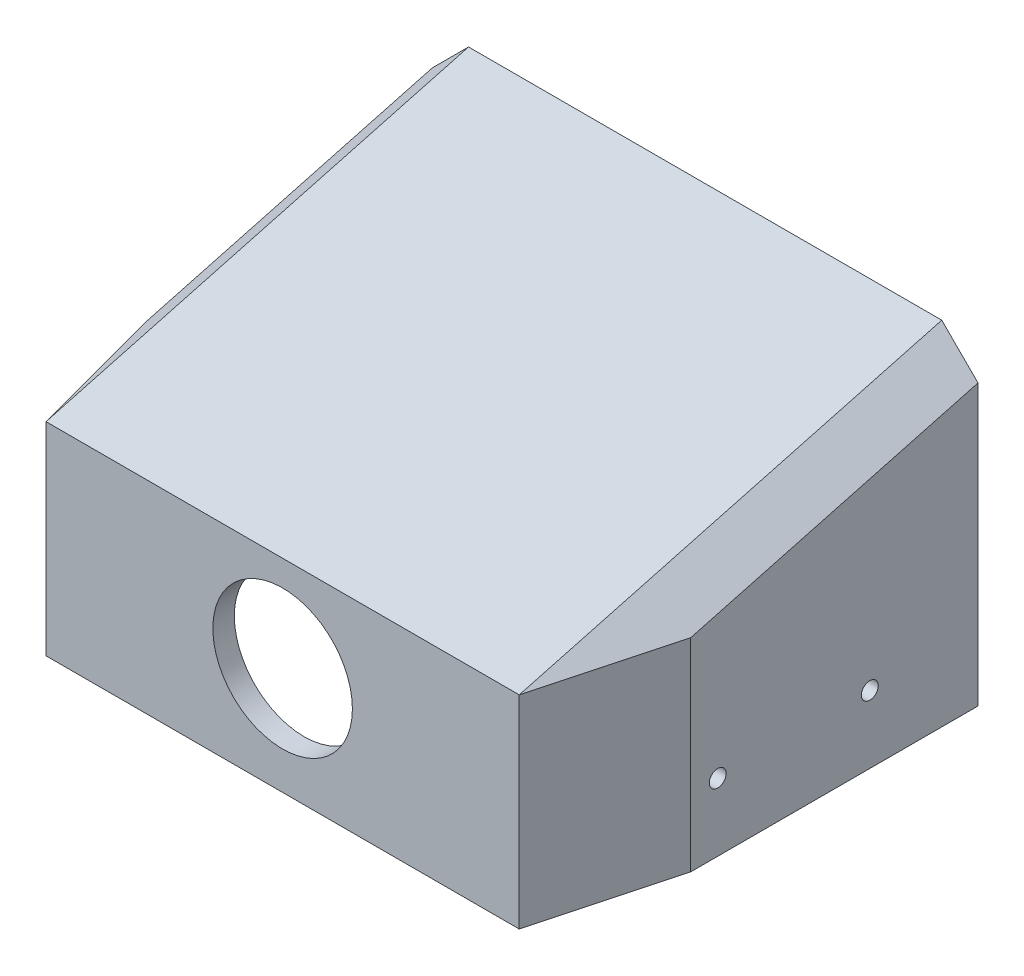
from build123d import *

# Parameters (mm, degrees)
BOSS_EXTRUDE1_DEPTH      = 60
BOSS_EXTRUDE2_DEPTH      = 70
BOSS_EXTRUDE2_DEPTH_BACK = 70
BOSS_EXTRUDE3_DEPTH      = 125
SKETCH5_W                = 177.8
SKETCH5_H                = 177.8
CUT_EXTRUDE1_DEPTH       = 206.048289966
SKETCH6_W                = 177.8
SKETCH6_H                = 177.8
CUT_EXTRUDE2_DEPTH       = 206.048289966
CUT_EXTRUDE5_START       = 93.49365
SKETCH10_W               = 39.282032303
SKETCH10_H               = 90
CUT_EXTRUDE5_DEPTH       = 247.327703168
SHELL1_T                 = -6.35
SKETCH7_R                = 20.64
CUT_EXTRUDE3_DEPTH       = 25.4
CUT_EXTRUDE4_START       = -25.4
SKETCH8_R                = 20.64
CUT_EXTRUDE4_DEPTH       = 25.4
CUT_EXTRUDE6_DEPTH       = 139.429414225
CUT_EXTRUDE6_DEPTH_BACK  = 139.429414225
SKETCH11_R               = 2.5


with BuildPart() as part:
    # Sketch1 → Boss-Extrude1 (new body)
    with BuildSketch(Plane(origin=(0, 0, 0), x_dir=(1, 0, 0), z_dir=(0, 1, 0))):
        Polygon((-103.493649054, 62.5), (103.493649054, 62.5), (70, -62.5), (-70, -62.5), align=None)
    extrude(amount=BOSS_EXTRUDE1_DEPTH)

    # Sketch2 → Boss-Extrude2 (add, two sides: drawn at the far end of the back side and taken through both)
    with BuildSketch(Plane(origin=(0, 0, 0), x_dir=(0, 0, -1), z_dir=(1, 0, 0)).offset(-BOSS_EXTRUDE2_DEPTH_BACK)):
        Polygon((-62.5, 60), (62.5, 93.493649054), (62.5, 60), align=None)
    extrude(amount=BOSS_EXTRUDE2_DEPTH + BOSS_EXTRUDE2_DEPTH_BACK)

    # Sketch4 → Boss-Extrude3 (add)
    with BuildSketch(Plane(origin=(0, 0, -62.5), x_dir=(-1, 0, 0), z_dir=(0, 0, -1))):
        Polygon((-70, 93.493649054), (-70, 60), (-103.493649054, 60), align=None)
        Polygon((70, 60), (103.493649054, 60), (70, 93.493649054), align=None)
    extrude(amount=-BOSS_EXTRUDE3_DEPTH)

    # Sketch5 → Cut-Extrude1 (cut, through all)
    with BuildSketch(Plane(origin=(70.830704378, 70.830704378, 18.979030037), x_dir=(0.7186724352001954, -0.6601192398037351, -0.21852350016499306), z_dir=(0.6947465906068516, 0.6947465906068802, 0.18615678789738468))):
        Rectangle(SKETCH5_W, SKETCH5_H)
    extrude(amount=CUT_EXTRUDE1_DEPTH, mode=Mode.SUBTRACT)

    # Sketch6 → Cut-Extrude2 (cut, through all)
    with BuildSketch(Plane(origin=(-70.830704378, 70.830704378, 18.979030037), x_dir=(0.7186724352001954, 0.6601192398037351, 0.21852350016499306), z_dir=(-0.6947465906068516, 0.6947465906068802, 0.18615678789738468))):
        Rectangle(SKETCH6_W, SKETCH6_H)
    extrude(amount=CUT_EXTRUDE2_DEPTH, mode=Mode.SUBTRACT)

    # Sketch10 → Cut-Extrude5 (cut, through all)
    with BuildSketch(Plane(origin=(0, 0, 0), x_dir=(1, 0, 0), z_dir=(0, 1, 0)).offset(CUT_EXTRUDE5_START)):
        with Locations((-100.358983849, 22.5)):
            Rectangle(SKETCH10_W, SKETCH10_H)
        with Locations((100.358983849, 22.5)):
            Rectangle(SKETCH10_W, SKETCH10_H)
    extrude(amount=-CUT_EXTRUDE5_DEPTH, mode=Mode.SUBTRACT)

    # Shell1
    shell1_openings = [part.faces().sort_by_distance(p)[0] for p in [
        (0, 0, -1.067232638),
    ]]
    offset(amount=SHELL1_T, openings=shell1_openings, kind=Kind.INTERSECTION)

    # Sketch7 → Cut-Extrude3 (cut)
    with BuildSketch(Plane(origin=(0, 0, -62.5), x_dir=(-1, 0, 0), z_dir=(0, 0, -1))):
        with Locations((0, 31.75)):
            Circle(SKETCH7_R)
    extrude(amount=-CUT_EXTRUDE3_DEPTH, mode=Mode.SUBTRACT)

    # Sketch8 → Cut-Extrude4 (cut)
    with BuildSketch(Plane.XY.offset(62.5).offset(CUT_EXTRUDE4_START)):
        with Locations(Location((0, 31.75, 0), (0, 0, 180))):
            Circle(SKETCH8_R)
    extrude(amount=CUT_EXTRUDE4_DEPTH, mode=Mode.SUBTRACT)

    # Sketch11 → Cut-Extrude6 (cut, two sides: drawn at the far end of the back side and taken through both)
    with BuildSketch(Plane(origin=(0, 0, 0), x_dir=(0, 0, -1), z_dir=(1, 0, 0)).offset(-CUT_EXTRUDE6_DEPTH_BACK)):
        with Locations((-14.5, 20)):
            Circle(SKETCH11_R)
        with Locations((30.5, 20)):
            Circle(SKETCH11_R)
    extrude(amount=CUT_EXTRUDE6_DEPTH + CUT_EXTRUDE6_DEPTH_BACK, mode=Mode.SUBTRACT)


solid = part.part
